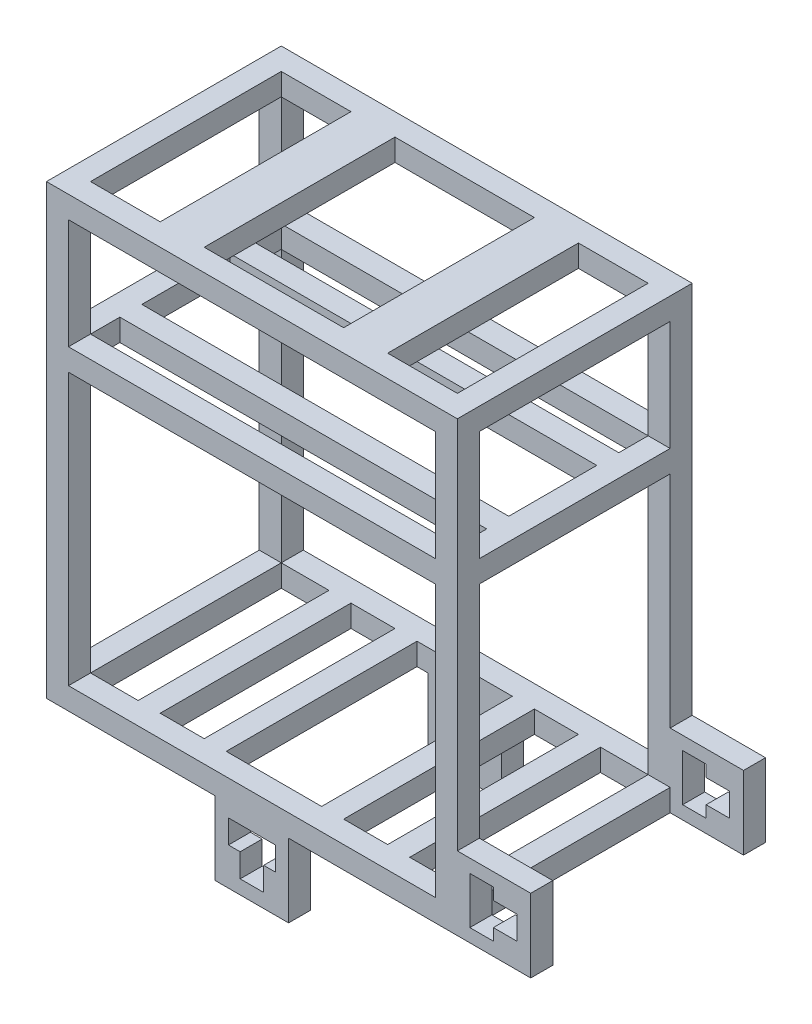
from build123d import *

# Parameters (mm, degrees)
SKETCH1_W           = 56
SKETCH1_H           = 32
SKETCH1_W_2         = 50
SKETCH1_H_2         = 26
BOSS_EXTRUDE1_DEPTH = 3
SKETCH2_W           = 3
SKETCH2_H           = 3
BOSS_EXTRUDE2_DEPTH = 40
BOSS_EXTRUDE3_DEPTH = 3
BOSS_EXTRUDE4_DEPTH = 3
SKETCH5_W           = 3
SKETCH5_H           = 26
BOSS_EXTRUDE5_DEPTH = 3
SKETCH6_W           = 50
SKETCH6_H           = 3
SKETCH6_W_2         = 3
BOSS_EXTRUDE7_DEPTH = 3
SKETCH7_W           = 3
SKETCH7_H           = 3
BOSS_EXTRUDE8_DEPTH = 15
SKETCH8_W           = 3
SKETCH8_H           = 26
SKETCH8_W_2         = 6
SKETCH8_H_2         = 3
BOSS_EXTRUDE9_DEPTH = 3


with BuildPart() as part:
    # Sketch1 → Boss-Extrude1 (new body)
    with BuildSketch(Plane(origin=(0, 0, 0), x_dir=(1, 0, 0), z_dir=(0, 1, 0))):
        Rectangle(SKETCH1_W, SKETCH1_H)
        Rectangle(SKETCH1_W_2, SKETCH1_H_2, mode=Mode.SUBTRACT)
    extrude(amount=BOSS_EXTRUDE1_DEPTH)

    # Sketch2 → Boss-Extrude2 (add)
    with BuildSketch(Plane(origin=(0, 0, 0), x_dir=(1, 0, 0), z_dir=(0, 1, 0))):
        with Locations((26.5, 14.5)):
            Rectangle(SKETCH2_W, SKETCH2_H)
        with Locations((26.5, -14.5)):
            Rectangle(SKETCH2_W, SKETCH2_H)
        with Locations((-26.5, -14.5)):
            Rectangle(SKETCH2_W, SKETCH2_H)
        with Locations((-26.5, 14.5)):
            Rectangle(SKETCH2_W, SKETCH2_H)
    extrude(amount=BOSS_EXTRUDE2_DEPTH)

    # Sketch3 → Boss-Extrude3 (add)
    with BuildSketch(Plane.XY.offset(16)):
        Polygon((28, 10), (28, 5), (29.7, 5), (29.7, 8.2), (32.9, 8.2), (32.9, 6.6), (36.1, 6.6), (36.1, 5), (38, 5), (38, 10), align=None)
        Polygon((28, 5), (28, 0), (38, 0), (38, 5), (36.1, 5), (36.1, 3.4), (32.9, 3.4), (32.9, 1.8), (29.7, 1.8), (29.7, 5), align=None)
    boss_extrude3 = extrude(amount=-BOSS_EXTRUDE3_DEPTH)

    # Mirror1: Boss-Extrude3 across plane
    add(boss_extrude3.mirror(Plane.XY))

    # Sketch4 → Boss-Extrude4 (add)
    with BuildSketch(Plane.XY.offset(16)):
        Polygon((5, 0), (0, 0), (-5, 0), (-5, -10), (0, -10), (5, -10), align=None)
        Polygon((1.6, -8.1), (0, -8.1), (-1.6, -8.1), (-1.6, -4.9), (-3.2, -4.9), (-3.2, -1.7), (3.2, -1.7), (3.2, -4.9), (1.6, -4.9), align=None, mode=Mode.SUBTRACT)
    boss_extrude4 = extrude(amount=-BOSS_EXTRUDE4_DEPTH)

    # Mirror2: Boss-Extrude4 across plane
    add(boss_extrude4.mirror(Plane.XY))

    # Sketch5 → Boss-Extrude5 (add)
    with BuildSketch(Plane(origin=(0, 3, 0), x_dir=(1, 0, 0), z_dir=(0, 1, 0))):
        with Locations((-17, 0)):
            Rectangle(SKETCH5_W, SKETCH5_H)
        with Locations((-8, 0)):
            Rectangle(SKETCH5_W, SKETCH5_H)
        with Locations((8, 0)):
            Rectangle(SKETCH5_W, SKETCH5_H)
        with Locations((17, 0)):
            Rectangle(SKETCH5_W, SKETCH5_H)
    extrude(amount=-BOSS_EXTRUDE5_DEPTH)

    # Sketch6 → Boss-Extrude7 (add)
    # profile 1 of 4: a face of its own
    with BuildSketch(Plane(origin=(0, 40, 0), x_dir=(1, 0, 0), z_dir=(0, 1, 0))):
        Polygon((-28, -16), (25, -16), (25, -13), (28, -13), (28, 16), (-28, 16), align=None)
        Polygon((25, -9), (25, -13), (-25, -13), (-25, -9), (-25, -6), (-25, 6), (-25, 9), (-25, 13), (25, 13), (25, 9), (25, 6), (25, -6), align=None, mode=Mode.SUBTRACT)
    # profile 2 of 4: a face of its own
    with BuildSketch(Plane(origin=(0, 40, 0), x_dir=(1, 0, 0), z_dir=(0, 1, 0))):
        with Locations((0, -7.5)):
            Rectangle(SKETCH6_W, SKETCH6_H)
    # profile 3 of 4: a face of its own
    with BuildSketch(Plane(origin=(0, 40, 0), x_dir=(1, 0, 0), z_dir=(0, 1, 0))):
        with Locations((0, 7.5)):
            Rectangle(SKETCH6_W, SKETCH6_H)
    # profile 4 of 4: a face of its own
    with BuildSketch(Plane(origin=(0, 40, 0), x_dir=(1, 0, 0), z_dir=(0, 1, 0))):
        with Locations((26.5, -14.5)):
            Rectangle(SKETCH6_W_2, SKETCH6_H)
    extrude(amount=BOSS_EXTRUDE7_DEPTH)

    # Sketch7 → Boss-Extrude8 (add)
    with BuildSketch(Plane(origin=(0, 43, 0), x_dir=(1, 0, 0), z_dir=(0, 1, 0))):
        with Locations((-26.5, -14.5)):
            Rectangle(SKETCH7_W, SKETCH7_H)
        with Locations((-26.5, 14.5)):
            Rectangle(SKETCH7_W, SKETCH7_H)
        with Locations((26.5, 14.5)):
            Rectangle(SKETCH7_W, SKETCH7_H)
        with Locations((26.5, -14.5)):
            Rectangle(SKETCH7_W, SKETCH7_H)
    extrude(amount=BOSS_EXTRUDE8_DEPTH)

    # Sketch8 → Boss-Extrude9 (add)
    # profile 1 of 5: a face of its own
    with BuildSketch(Plane(origin=(0, 58, 0), x_dir=(1, 0, 0), z_dir=(0, 1, 0))):
        Polygon((-25, 16), (-25, 13), (-28, 13), (-28, -16), (28, -16), (28, 16), align=None)
        Polygon((25, 13), (25, -13), (15.5, -13), (12.5, -13), (9.5, -13), (0, -13), (-9.5, -13), (-15.5, -13), (-25, -13), (-25, 13), (-15.5, 13), (-9.5, 13), (9.5, 13), (12.5, 13), (15.5, 13), align=None, mode=Mode.SUBTRACT)
    # profile 2 of 5: a face of its own
    with BuildSketch(Plane(origin=(0, 58, 0), x_dir=(1, 0, 0), z_dir=(0, 1, 0))):
        with Locations((11, 0)):
            Rectangle(SKETCH8_W, SKETCH8_H)
    # profile 3 of 5: a face of its own
    with BuildSketch(Plane(origin=(0, 58, 0), x_dir=(1, 0, 0), z_dir=(0, 1, 0))):
        with Locations((14, 0)):
            Rectangle(SKETCH8_W, SKETCH8_H)
    # profile 4 of 5: a face of its own
    with BuildSketch(Plane(origin=(0, 58, 0), x_dir=(1, 0, 0), z_dir=(0, 1, 0))):
        with Locations((-12.5, 0)):
            Rectangle(SKETCH8_W_2, SKETCH8_H)
    # profile 5 of 5: a face of its own
    with BuildSketch(Plane(origin=(0, 58, 0), x_dir=(1, 0, 0), z_dir=(0, 1, 0))):
        with Locations((-26.5, 14.5)):
            Rectangle(SKETCH8_W, SKETCH8_H_2)
    extrude(amount=BOSS_EXTRUDE9_DEPTH)


solid = part.part
